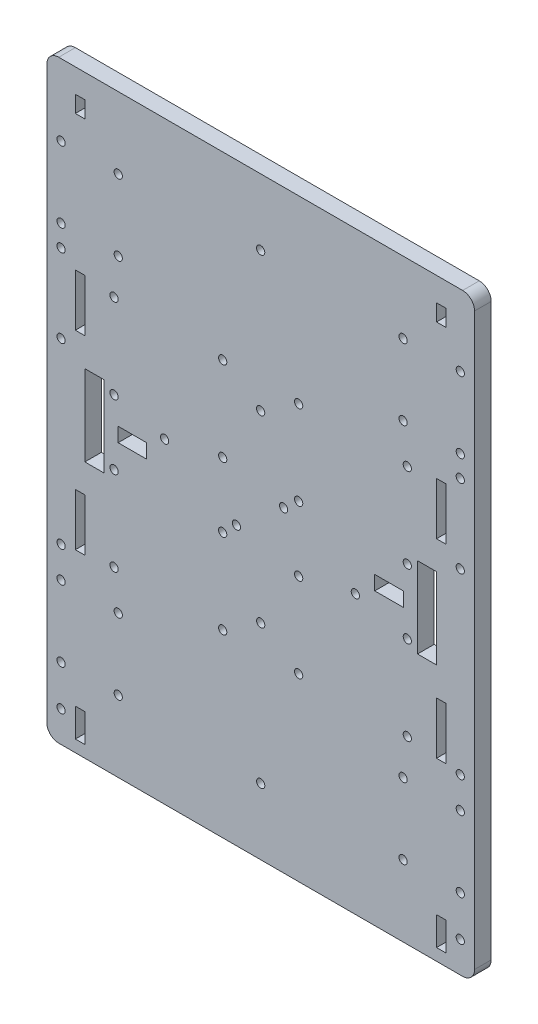
from build123d import *

# Parameters (mm, degrees)
SKETCH1_W               = 180
SKETCH1_H               = 250
BOSS_EXTRUDE1_DEPTH     = 7
FILLET1_R               = 5
SKETCH4_R               = 1.73
CUT_EXTRUDE2_DEPTH      = 7
MIRROR4_COPY_1_SKETCH_R = 1.73
MIRROR4_COPY_1_DEPTH    = 7
SKETCH6_R               = 1.73
CUT_EXTRUDE3_DEPTH      = 7
MIRROR7_COPY_1_SKETCH_R = 1.73
MIRROR7_COPY_1_DEPTH    = 7
SKETCH7_R               = 1.73
CUT_EXTRUDE5_DEPTH      = 7
CUT_EXTRUDE8_DEPTH      = 7
SKETCH10_W              = 4
SKETCH10_H              = 7
CUT_EXTRUDE14_DEPTH     = 7
SKETCH10_9_W            = 4
SKETCH10_9_H            = 22
CUT_EXTRUDE15_DEPTH     = 7
SKETCH10_10_W           = 4
SKETCH10_10_H           = 22
CUT_EXTRUDE16_DEPTH     = 7
SKETCH10_11_W           = 4
SKETCH10_11_H           = 12
CUT_EXTRUDE17_DEPTH     = 7
SKETCH16_R              = 1.73
CUT_EXTRUDE18_DEPTH     = 7
SKETCH17_R              = 1.73
CUT_EXTRUDE19_DEPTH     = 7


with BuildPart() as part:
    # Sketch1 → Boss-Extrude1 (new body)
    with BuildSketch(Plane.XY):
        Rectangle(SKETCH1_W, SKETCH1_H)
    extrude(amount=BOSS_EXTRUDE1_DEPTH)

    # Fillet1
    fillet1_edges = [part.edges().sort_by_distance(p)[0] for p in [
        (90, -125, 3.5),
        (-90, -125, 3.5),
        (-90, 125, 3.5),
        (90, 125, 3.5),
    ]]
    fillet(fillet1_edges, radius=FILLET1_R)

    # Sketch4 → Cut-Extrude2 (cut)
    with BuildSketch(Plane(origin=(0, 0, 0), x_dir=(-1, 0, 0), z_dir=(0, 0, -1))):
        with Locations((-59.94, 94.96)):
            Circle(SKETCH4_R)
        with Locations((-84, 94.96)):
            Circle(SKETCH4_R)
        with Locations((-84, 65.04)):
            Circle(SKETCH4_R)
        with Locations((-59.94, 65.04)):
            Circle(SKETCH4_R)
    cut_extrude2 = extrude(amount=-CUT_EXTRUDE2_DEPTH, mode=Mode.SUBTRACT)

    # Mirror3: Cut-Extrude2 across plane
    add(cut_extrude2.mirror(Plane(origin=(0, 0, 0), x_dir=(0, 0, 1), z_dir=(1, 0, 0))), mode=Mode.SUBTRACT)

    # Mirror4: Cut-Extrude2 across plane
    add(cut_extrude2.mirror(Plane.ZX), mode=Mode.SUBTRACT)

    # Mirror4 copy 1 sketch → Mirror4 copy 1 (cut)
    with BuildSketch(Plane(origin=(0, 0, 0), x_dir=(1, 0, 0), z_dir=(0, 0, -1))):
        with Locations((-59.94, 94.96)):
            Circle(MIRROR4_COPY_1_SKETCH_R)
        with Locations((-84, 94.96)):
            Circle(MIRROR4_COPY_1_SKETCH_R)
        with Locations((-84, 65.04)):
            Circle(MIRROR4_COPY_1_SKETCH_R)
        with Locations((-59.94, 65.04)):
            Circle(MIRROR4_COPY_1_SKETCH_R)
    extrude(amount=-MIRROR4_COPY_1_DEPTH, mode=Mode.SUBTRACT)

    # Sketch6 → Cut-Extrude3 (cut)
    with BuildSketch(Plane(origin=(0, 0, 0), x_dir=(-1, 0, 0), z_dir=(0, 0, -1))):
        with Locations((61.71, -13.64)):
            Circle(SKETCH6_R)
        with Locations((15.99, -13.64)):
            Circle(SKETCH6_R)
        with Locations((15.99, -49.2)):
            Circle(SKETCH6_R)
        with Locations((61.71, -49.2)):
            Circle(SKETCH6_R)
    cut_extrude3 = extrude(amount=-CUT_EXTRUDE3_DEPTH, mode=Mode.SUBTRACT)

    # Mirror5: Cut-Extrude3 across plane
    add(cut_extrude3.mirror(Plane(origin=(0, 0, 0), x_dir=(0, 0, 1), z_dir=(1, 0, 0))), mode=Mode.SUBTRACT)

    # Mirror7: Cut-Extrude3 across plane
    add(cut_extrude3.mirror(Plane.ZX), mode=Mode.SUBTRACT)

    # Mirror7 copy 1 sketch → Mirror7 copy 1 (cut)
    with BuildSketch(Plane(origin=(0, 0, 0), x_dir=(1, 0, 0), z_dir=(0, 0, -1))):
        with Locations((61.71, -13.64)):
            Circle(MIRROR7_COPY_1_SKETCH_R)
        with Locations((15.99, -13.64)):
            Circle(MIRROR7_COPY_1_SKETCH_R)
        with Locations((15.99, -49.2)):
            Circle(MIRROR7_COPY_1_SKETCH_R)
        with Locations((61.71, -49.2)):
            Circle(MIRROR7_COPY_1_SKETCH_R)
    extrude(amount=-MIRROR7_COPY_1_DEPTH, mode=Mode.SUBTRACT)

    # Sketch7 → Cut-Extrude5 (cut)
    with BuildSketch(Plane(origin=(0, 0, 0), x_dir=(-1, 0, 0), z_dir=(0, 0, -1))):
        with Locations((-9.635797548, 8.125)):
            Circle(SKETCH7_R)
        with Locations((10.22, -8.125)):
            Circle(SKETCH7_R)
        with Locations((-39.835797548, -8.125)):
            Circle(SKETCH7_R)
        with Locations((40.42, 8.125)):
            Circle(SKETCH7_R)
    extrude(amount=-CUT_EXTRUDE5_DEPTH, mode=Mode.SUBTRACT)

    # Sketch9 → Cut-Extrude8 (cut)
    with BuildSketch(Plane(origin=(0, 0, 0), x_dir=(-1, 0, 0), z_dir=(0, 0, -1))):
        Polygon((74, 0), (74, 17), (66, 17), (66, -17), (74, -17), align=None)
        Polygon((60, 0), (60, 3), (48, 3), (48, -3), (60, -3), align=None)
    cut_extrude8 = extrude(amount=-CUT_EXTRUDE8_DEPTH, mode=Mode.SUBTRACT)

    # Mirror9: Cut-Extrude8 across plane
    add(cut_extrude8.mirror(Plane(origin=(0, 0, 0), x_dir=(0, 0, 1), z_dir=(1, 0, 0))), mode=Mode.SUBTRACT)

    # Sketch10 → Cut-Extrude14 (cut)
    with BuildSketch(Plane.XY.offset(7)):
        with Locations((76, 111.5)):
            Rectangle(SKETCH10_W, SKETCH10_H)
    cut_extrude14 = extrude(amount=-CUT_EXTRUDE14_DEPTH, mode=Mode.SUBTRACT)

    # Sketch10<9> → Cut-Extrude15 (cut)
    with BuildSketch(Plane.XY.offset(7)):
        with Locations((76, 40)):
            Rectangle(SKETCH10_9_W, SKETCH10_9_H)
    cut_extrude15 = extrude(amount=-CUT_EXTRUDE15_DEPTH, mode=Mode.SUBTRACT)

    # Sketch10<10> → Cut-Extrude16 (cut)
    with BuildSketch(Plane.XY.offset(7)):
        with Locations((76, -40)):
            Rectangle(SKETCH10_10_W, SKETCH10_10_H)
    cut_extrude16 = extrude(amount=-CUT_EXTRUDE16_DEPTH, mode=Mode.SUBTRACT)

    # Sketch10<11> → Cut-Extrude17 (cut)
    with BuildSketch(Plane.XY.offset(7)):
        with Locations((76, -114)):
            Rectangle(SKETCH10_11_W, SKETCH10_11_H)
    cut_extrude17 = extrude(amount=-CUT_EXTRUDE17_DEPTH, mode=Mode.SUBTRACT)

    # Mirror11: Cut-Extrude14, Cut-Extrude15, Cut-Extrude16, Cut-Extrude17 across plane
    add(cut_extrude14.mirror(Plane(origin=(0, 0, 0), x_dir=(0, 0, 1), z_dir=(1, 0, 0))), mode=Mode.SUBTRACT)
    add(cut_extrude15.mirror(Plane(origin=(0, 0, 0), x_dir=(0, 0, 1), z_dir=(1, 0, 0))), mode=Mode.SUBTRACT)
    add(cut_extrude16.mirror(Plane(origin=(0, 0, 0), x_dir=(0, 0, 1), z_dir=(1, 0, 0))), mode=Mode.SUBTRACT)
    add(cut_extrude17.mirror(Plane(origin=(0, 0, 0), x_dir=(0, 0, 1), z_dir=(1, 0, 0))), mode=Mode.SUBTRACT)

    # Sketch16 → Cut-Extrude18 (cut)
    with BuildSketch(Plane.XY.offset(7)):
        with Locations((84, -112)):
            Circle(SKETCH16_R)
        with Locations((84, -52)):
            Circle(SKETCH16_R)
        with Locations((84, 23)):
            Circle(SKETCH16_R)
        with Locations((84, 56)):
            Circle(SKETCH16_R)
    cut_extrude18 = extrude(amount=-CUT_EXTRUDE18_DEPTH, mode=Mode.SUBTRACT)

    # Mirror12: Cut-Extrude18 across plane
    add(cut_extrude18.mirror(Plane(origin=(0, 0, 0), x_dir=(0, 0, 1), z_dir=(1, 0, 0))), mode=Mode.SUBTRACT)

    # Sketch17 → Cut-Extrude19 (cut)
    with BuildSketch(Plane(origin=(0, 0, 0), x_dir=(-1, 0, 0), z_dir=(0, 0, -1))):
        with Locations((0, -97.16)):
            Circle(SKETCH17_R)
        with Locations((0, -38.66)):
            Circle(SKETCH17_R)
        with Locations((0, 97.16)):
            Circle(SKETCH17_R)
        with Locations((0, 38.66)):
            Circle(SKETCH17_R)
    extrude(amount=-CUT_EXTRUDE19_DEPTH, mode=Mode.SUBTRACT)


solid = part.part
